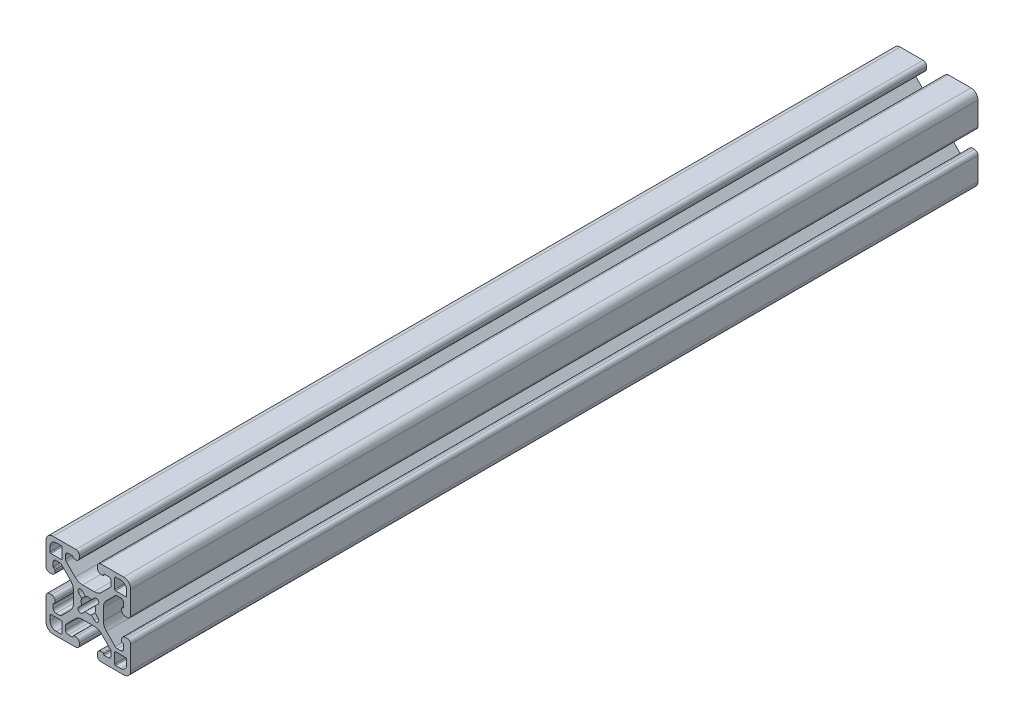
from build123d import *

# Parameters (mm, degrees)
EXTRUDE1_DEPTH = 381


with BuildPart() as part:
    # Sketch1 → Extrude1 (new body)
    with BuildSketch(Plane.XY):
        with BuildLine():
            Line((-46.536752228, -7.000622168), (-46.536752228, -8.774580164))
            ThreePointArc((-46.536752228, -8.774580164), (-46.907290083, -9.675221514), (-47.806745776, -10.048628264))
            Line((-47.806745776, -10.048628264), (-49.392633083, -10.048628264))
            ThreePointArc((-49.392633083, -10.048628264), (-49.878641042, -9.95195527), (-50.290658695, -9.676653876))
            Line((-50.290658695, -9.676653876), (-54.238761565, -5.728551005))
            ThreePointArc((-54.238761565, -5.728551005), (-55.26838878, -4.187604983), (-55.629945776, -2.369935216))
            Line((-55.629945776, -2.369935216), (-55.629945776, 2.846678689))
            ThreePointArc((-55.629945776, 2.846678689), (-55.26838878, 4.664348456), (-54.238761565, 6.205294478))
            Line((-54.238761565, 6.205294478), (-50.290658695, 10.153397348))
            ThreePointArc((-50.290658695, 10.153397348), (-49.878641042, 10.428698742), (-49.392633083, 10.525371736))
            Line((-49.392633083, 10.525371736), (-47.806745776, 10.525371736))
            ThreePointArc((-47.806745776, 10.525371736), (-46.907290079, 10.151964982), (-46.536752228, 9.251323623))
            Line((-46.536752228, 9.251323623), (-46.536752228, 7.47736564))
            ThreePointArc((-46.536752228, 7.47736564), (-46.648344767, 7.207957418), (-46.91775299, 7.096364878))
            Line((-46.91775299, 7.096364878), (-46.993953142, 7.096364878))
            ThreePointArc((-46.993953142, 7.096364878), (-47.263362671, 6.984771032), (-47.374953904, 6.715360422))
            Line((-47.374953904, 6.715360422), (-47.374945776, 5.877156465))
            ThreePointArc((-47.374945776, 5.877156465), (-46.913692136, 4.763614578), (-45.800145776, 4.302371736))
            Line((-45.800145776, 4.302371736), (-44.885745776, 4.302371736))
            ThreePointArc((-44.885745776, 4.302371736), (-43.772194017, 4.763619977), (-43.310945776, 5.877171736))
            Line((-43.310945776, 5.877171736), (-43.310945776, 16.113371736))
            ThreePointArc((-43.310945776, 16.113371736), (-44.240881746, 18.358435766), (-46.485945776, 19.288371736))
            Line((-46.485945776, 19.288371736), (-56.722145776, 19.288371736))
            ThreePointArc((-56.722145776, 19.288371736), (-57.835697535, 18.827123495), (-58.296945776, 17.713571736))
            Line((-58.296945776, 17.713571736), (-58.296945776, 16.799171736))
            ThreePointArc((-58.296945776, 16.799171736), (-57.835702934, 15.685625376), (-56.722161047, 15.224371736))
            Line((-56.722161047, 15.224371736), (-55.883957091, 15.224363608))
            ThreePointArc((-55.883957091, 15.224363608), (-55.61454648, 15.335954841), (-55.502952634, 15.60536437))
            Line((-55.502952634, 15.60536437), (-55.502952634, 15.681564523))
            ThreePointArc((-55.502952634, 15.681564523), (-55.391360095, 15.950972745), (-55.121951872, 16.062565285))
            Line((-55.121951872, 16.062565285), (-53.347993876, 16.062565285))
            ThreePointArc((-53.347993876, 16.062565285), (-52.447352526, 15.692027429), (-52.073945776, 14.792571736))
            Line((-52.073945776, 14.792571736), (-52.073945776, 13.206684429))
            ThreePointArc((-52.073945776, 13.206684429), (-52.17061877, 12.72067647), (-52.445920164, 12.308658817))
            Line((-52.445920164, 12.308658817), (-56.394023034, 8.360555947))
            ThreePointArc((-56.394023034, 8.360555947), (-57.934969057, 7.330928733), (-59.752638824, 6.969371736))
            Line((-59.752638824, 6.969371736), (-64.969252728, 6.969371736))
            ThreePointArc((-64.969252728, 6.969371736), (-66.786922495, 7.330928733), (-68.327868518, 8.360555947))
            Line((-68.327868518, 8.360555947), (-72.275971388, 12.308658817))
            ThreePointArc((-72.275971388, 12.308658817), (-72.551272782, 12.72067647), (-72.647945776, 13.206684429))
            Line((-72.647945776, 13.206684429), (-72.647945776, 14.792571736))
            ThreePointArc((-72.647945776, 14.792571736), (-72.274539022, 15.692027434), (-71.373897663, 16.062565285))
            Line((-71.373897663, 16.062565285), (-69.59993968, 16.062565285))
            ThreePointArc((-69.59993968, 16.062565285), (-69.330531458, 15.950972745), (-69.218938918, 15.681564523))
            Line((-69.218938918, 15.681564523), (-69.218938918, 15.60536437))
            ThreePointArc((-69.218938918, 15.60536437), (-69.107345072, 15.335954841), (-68.837934461, 15.224363608))
            Line((-68.837934461, 15.224363608), (-67.999730505, 15.224371736))
            ThreePointArc((-67.999730505, 15.224371736), (-66.886188618, 15.685625376), (-66.424945776, 16.799171736))
            Line((-66.424945776, 16.799171736), (-66.424945776, 17.713571736))
            ThreePointArc((-66.424945776, 17.713571736), (-66.886194017, 18.827123495), (-67.999745776, 19.288371736))
            Line((-67.999745776, 19.288371736), (-78.235945776, 19.288371736))
            ThreePointArc((-78.235945776, 19.288371736), (-80.481009806, 18.358435766), (-81.410945776, 16.113371736))
            Line((-81.410945776, 16.113371736), (-81.410945776, 5.877171736))
            ThreePointArc((-81.410945776, 5.877171736), (-80.949697535, 4.763619977), (-79.836145776, 4.302371736))
            Line((-79.836145776, 4.302371736), (-78.921745776, 4.302371736))
            ThreePointArc((-78.921745776, 4.302371736), (-77.808199416, 4.763614578), (-77.346945776, 5.877156465))
            Line((-77.346945776, 5.877156465), (-77.346937648, 6.715360422))
            ThreePointArc((-77.346937648, 6.715360422), (-77.458528881, 6.984771032), (-77.72793841, 7.096364878))
            Line((-77.72793841, 7.096364878), (-77.804138562, 7.096364878))
            ThreePointArc((-77.804138562, 7.096364878), (-78.073546785, 7.207957418), (-78.185139324, 7.47736564))
            Line((-78.185139324, 7.47736564), (-78.185139324, 9.251323637))
            ThreePointArc((-78.185139324, 9.251323637), (-77.814601469, 10.151964987), (-76.915145776, 10.525371736))
            Line((-76.915145776, 10.525371736), (-75.329258469, 10.525371736))
            ThreePointArc((-75.329258469, 10.525371736), (-74.84325051, 10.428698742), (-74.431232857, 10.153397348))
            Line((-74.431232857, 10.153397348), (-70.483129987, 6.205294478))
            ThreePointArc((-70.483129987, 6.205294478), (-69.453502773, 4.664348456), (-69.091945776, 2.846678689))
            Line((-69.091945776, 2.846678689), (-69.091945776, -2.369935216))
            ThreePointArc((-69.091945776, -2.369935216), (-69.453502773, -4.187604983), (-70.483129987, -5.728551005))
            Line((-70.483129987, -5.728551005), (-74.431232857, -9.676653876))
            ThreePointArc((-74.431232857, -9.676653876), (-74.84325051, -9.95195527), (-75.329258469, -10.048628264))
            Line((-75.329258469, -10.048628264), (-76.915145776, -10.048628264))
            ThreePointArc((-76.915145776, -10.048628264), (-77.814601473, -9.67522151), (-78.185139324, -8.774580151))
            Line((-78.185139324, -8.774580151), (-78.185139324, -7.000622168))
            ThreePointArc((-78.185139324, -7.000622168), (-78.073546785, -6.731213945), (-77.804138562, -6.619621406))
            Line((-77.804138562, -6.619621406), (-77.72793841, -6.619621406))
            ThreePointArc((-77.72793841, -6.619621406), (-77.458528881, -6.50802756), (-77.346937648, -6.238616949))
            Line((-77.346937648, -6.238616949), (-77.346945776, -5.400412993))
            ThreePointArc((-77.346945776, -5.400412993), (-77.808199416, -4.286871106), (-78.921745776, -3.825628264))
            Line((-78.921745776, -3.825628264), (-79.836145776, -3.825628264))
            ThreePointArc((-79.836145776, -3.825628264), (-80.949697535, -4.286876505), (-81.410945776, -5.400428264))
            Line((-81.410945776, -5.400428264), (-81.410945776, -15.636628264))
            ThreePointArc((-81.410945776, -15.636628264), (-80.481009806, -17.881692294), (-78.235945776, -18.811628264))
            Line((-78.235945776, -18.811628264), (-67.999745776, -18.811628264))
            ThreePointArc((-67.999745776, -18.811628264), (-66.886194017, -18.350380023), (-66.424945776, -17.236828264))
            Line((-66.424945776, -17.236828264), (-66.424945776, -16.322428264))
            ThreePointArc((-66.424945776, -16.322428264), (-66.886188618, -15.208881904), (-67.999730505, -14.747628264))
            Line((-67.999730505, -14.747628264), (-68.837934461, -14.747620136))
            ThreePointArc((-68.837934461, -14.747620136), (-69.107345072, -14.859211369), (-69.218938918, -15.128620898))
            Line((-69.218938918, -15.128620898), (-69.218938918, -15.20482105))
            ThreePointArc((-69.218938918, -15.20482105), (-69.330531458, -15.474229273), (-69.59993968, -15.585821812))
            Line((-69.59993968, -15.585821812), (-71.373897676, -15.585821812))
            ThreePointArc((-71.373897676, -15.585821812), (-72.274539027, -15.215283957), (-72.647945776, -14.315828264))
            Line((-72.647945776, -14.315828264), (-72.647945776, -12.729940957))
            ThreePointArc((-72.647945776, -12.729940957), (-72.551272782, -12.243932998), (-72.275971388, -11.831915345))
            Line((-72.275971388, -11.831915345), (-68.327868518, -7.883812475))
            ThreePointArc((-68.327868518, -7.883812475), (-66.786922495, -6.85418526), (-64.969252728, -6.492628264))
            Line((-64.969252728, -6.492628264), (-59.752638824, -6.492628264))
            ThreePointArc((-59.752638824, -6.492628264), (-57.934969057, -6.85418526), (-56.394023034, -7.883812475))
            Line((-56.394023034, -7.883812475), (-52.445920164, -11.831915345))
            ThreePointArc((-52.445920164, -11.831915345), (-52.17061877, -12.243932998), (-52.073945776, -12.729940957))
            Line((-52.073945776, -12.729940957), (-52.073945776, -14.315828264))
            ThreePointArc((-52.073945776, -14.315828264), (-52.44735253, -15.215283961), (-53.347993889, -15.585821812))
            Line((-53.347993889, -15.585821812), (-55.121951872, -15.585821812))
            ThreePointArc((-55.121951872, -15.585821812), (-55.391360095, -15.474229273), (-55.502952634, -15.20482105))
            Line((-55.502952634, -15.20482105), (-55.502952634, -15.128620898))
            ThreePointArc((-55.502952634, -15.128620898), (-55.61454648, -14.859211369), (-55.883957091, -14.747620136))
            Line((-55.883957091, -14.747620136), (-56.722161047, -14.747628264))
            ThreePointArc((-56.722161047, -14.747628264), (-57.835702934, -15.208881904), (-58.296945776, -16.322428264))
            Line((-58.296945776, -16.322428264), (-58.296945776, -17.236828264))
            ThreePointArc((-58.296945776, -17.236828264), (-57.835697535, -18.350380023), (-56.722145776, -18.811628264))
            Line((-56.722145776, -18.811628264), (-46.485945776, -18.811628264))
            ThreePointArc((-46.485945776, -18.811628264), (-44.240881746, -17.881692294), (-43.310945776, -15.636628264))
            Line((-43.310945776, -15.636628264), (-43.310945776, -5.400428264))
            ThreePointArc((-43.310945776, -5.400428264), (-43.772194017, -4.286876505), (-44.885745776, -3.825628264))
            Line((-44.885745776, -3.825628264), (-45.800145776, -3.825628264))
            ThreePointArc((-45.800145776, -3.825628264), (-46.913692136, -4.286871106), (-47.374945776, -5.400412993))
            Line((-47.374945776, -5.400412993), (-47.374953904, -6.238616949))
            ThreePointArc((-47.374953904, -6.238616949), (-47.263362671, -6.50802756), (-46.993953142, -6.619621406))
            Line((-46.993953142, -6.619621406), (-46.91775299, -6.619621406))
            ThreePointArc((-46.91775299, -6.619621406), (-46.648344767, -6.731213945), (-46.536752228, -7.000622168))
        make_face()
        with BuildLine():
            Line((-66.704246649, -2.488483035), (-65.333825803, -1.118062189))
            ThreePointArc((-65.333825803, -1.118062189), (-65.628655776, 0.238371736), (-65.333825803, 1.594805661))
            Line((-65.333825803, 1.594805661), (-66.704246649, 2.965226507))
            ThreePointArc((-66.704246649, 2.965226507), (-66.704246649, 4.581672609), (-65.087800547, 4.581672609))
            Line((-65.087800547, 4.581672609), (-63.717379701, 3.211251763))
            ThreePointArc((-63.717379701, 3.211251763), (-62.360945776, 3.506081736), (-61.004511851, 3.211251763))
            Line((-61.004511851, 3.211251763), (-59.721184579, 4.483982556))
            ThreePointArc((-59.721184579, 4.483982556), (-58.017644903, 4.581672609), (-58.115334956, 2.878132934))
            Line((-58.115334956, 2.878132934), (-59.38806575, 1.594805661))
            ThreePointArc((-59.38806575, 1.594805661), (-59.093235776, 0.238371736), (-59.38806575, -1.118062189))
            Line((-59.38806575, -1.118062189), (-58.017644903, -2.488483035))
            ThreePointArc((-58.017644903, -2.488483035), (-58.017644903, -4.104929137), (-59.634091005, -4.104929137))
            Line((-59.634091005, -4.104929137), (-61.004511851, -2.73450829))
            ThreePointArc((-61.004511851, -2.73450829), (-62.360945776, -3.029338264), (-63.717379701, -2.73450829))
            Line((-63.717379701, -2.73450829), (-65.087800547, -4.104929137))
            ThreePointArc((-65.087800547, -4.104929137), (-66.704246649, -4.104929137), (-66.704246649, -2.488483035))
        make_face(mode=Mode.SUBTRACT)
        with BuildLine():
            Line((-79.607545776, 12.481171736), (-79.607545776, 14.690971736))
            ThreePointArc((-79.607545776, 14.690971736), (-78.789202123, 16.666628083), (-76.813545776, 17.484971736))
            Line((-76.813545776, 17.484971736), (-74.603745776, 17.484971736))
            ThreePointArc((-74.603745776, 17.484971736), (-74.334338092, 17.37337942), (-74.222745776, 17.103971736))
            Line((-74.222745776, 17.103971736), (-74.222745776, 12.481171736))
            ThreePointArc((-74.222745776, 12.481171736), (-74.334338092, 12.211764053), (-74.603745776, 12.100171736))
            Line((-74.603745776, 12.100171736), (-79.226545776, 12.100171736))
            ThreePointArc((-79.226545776, 12.100171736), (-79.49595346, 12.211764053), (-79.607545776, 12.481171736))
        make_face(mode=Mode.SUBTRACT)
        with BuildLine():
            Line((-74.603745776, -17.008228264), (-76.813545776, -17.008228264))
            ThreePointArc((-76.813545776, -17.008228264), (-78.789202123, -16.18988461), (-79.607545776, -14.214228264))
            Line((-79.607545776, -14.214228264), (-79.607545776, -12.004428264))
            ThreePointArc((-79.607545776, -12.004428264), (-79.49595346, -11.73502058), (-79.226545776, -11.623428264))
            Line((-79.226545776, -11.623428264), (-74.603745776, -11.623428264))
            ThreePointArc((-74.603745776, -11.623428264), (-74.334338092, -11.73502058), (-74.222745776, -12.004428264))
            Line((-74.222745776, -12.004428264), (-74.222745776, -16.627228264))
            ThreePointArc((-74.222745776, -16.627228264), (-74.334338092, -16.896635947), (-74.603745776, -17.008228264))
        make_face(mode=Mode.SUBTRACT)
        with BuildLine():
            Line((-45.114345776, -12.004428264), (-45.114345776, -14.214228264))
            ThreePointArc((-45.114345776, -14.214228264), (-45.932689429, -16.18988461), (-47.908345776, -17.008228264))
            Line((-47.908345776, -17.008228264), (-50.118145776, -17.008228264))
            ThreePointArc((-50.118145776, -17.008228264), (-50.38755346, -16.896635947), (-50.499145776, -16.627228264))
            Line((-50.499145776, -16.627228264), (-50.499145776, -12.004428264))
            ThreePointArc((-50.499145776, -12.004428264), (-50.38755346, -11.73502058), (-50.118145776, -11.623428264))
            Line((-50.118145776, -11.623428264), (-45.495345776, -11.623428264))
            ThreePointArc((-45.495345776, -11.623428264), (-45.225938092, -11.73502058), (-45.114345776, -12.004428264))
        make_face(mode=Mode.SUBTRACT)
        with BuildLine():
            Line((-50.118145776, 17.484971736), (-47.908345776, 17.484971736))
            ThreePointArc((-47.908345776, 17.484971736), (-45.932689429, 16.666628083), (-45.114345776, 14.690971736))
            Line((-45.114345776, 14.690971736), (-45.114345776, 12.481171736))
            ThreePointArc((-45.114345776, 12.481171736), (-45.225938092, 12.211764053), (-45.495345776, 12.100171736))
            Line((-45.495345776, 12.100171736), (-50.118145776, 12.100171736))
            ThreePointArc((-50.118145776, 12.100171736), (-50.38755346, 12.211764053), (-50.499145776, 12.481171736))
            Line((-50.499145776, 12.481171736), (-50.499145776, 17.103971736))
            ThreePointArc((-50.499145776, 17.103971736), (-50.38755346, 17.37337942), (-50.118145776, 17.484971736))
        make_face(mode=Mode.SUBTRACT)
    extrude(amount=-EXTRUDE1_DEPTH)


solid = part.part
